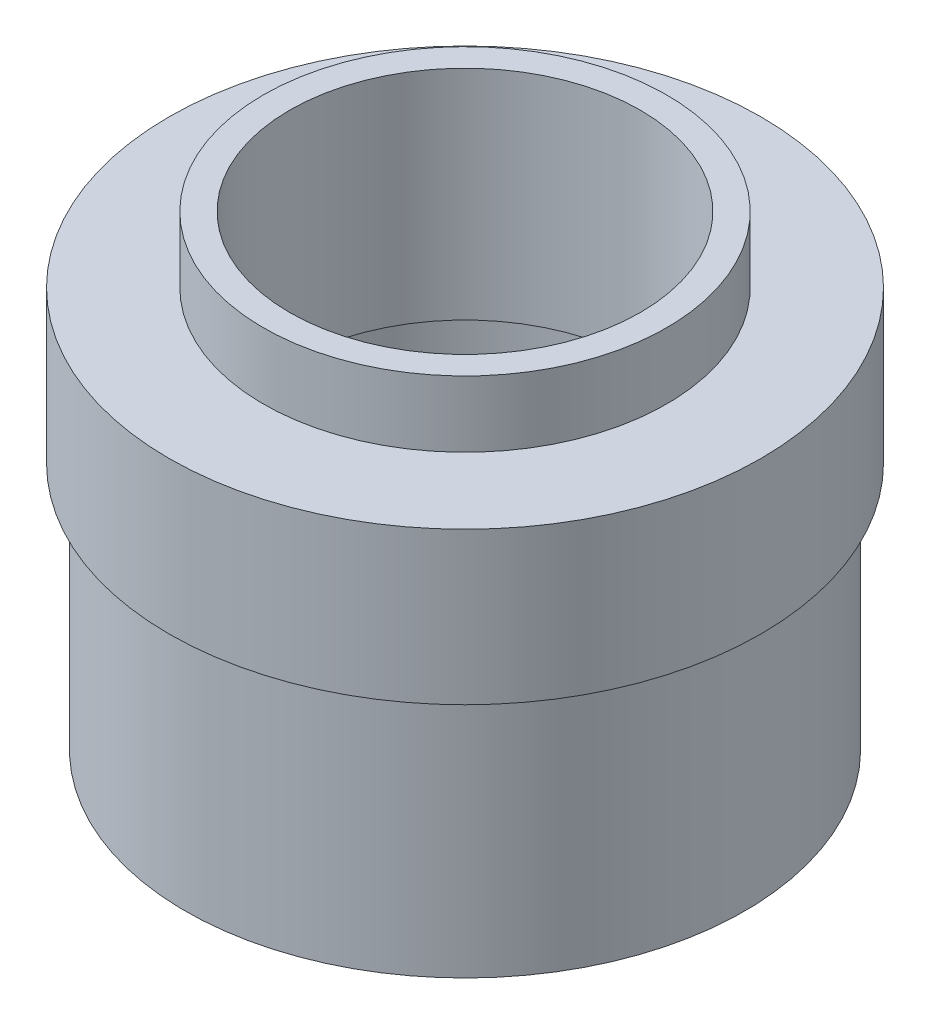
from build123d import *

# Parameters (mm, degrees)
SKETCH2_R          = 12.319
CUT_EXTRUDE2_DEPTH = 15.5448
SKETCH3_R          = 10.9855
CUT_EXTRUDE3_DEPTH = 40.253479183


with BuildPart() as part:
    # Sketch1 → Revolve2 (revolve)
    with BuildSketch(Plane.XY):
        Polygon((-18.542, 15.5448), (-17.526, 15.5448), (-17.526, 0), (0, 0), (0, 29.21), (-12.6365, 29.21), (-12.6365, 25.0698), (-18.542, 25.0698), align=None)
    revolve(axis=Axis((0, 29.21, 0), (0, -1, 0)))

    # Sketch2 → Cut-Extrude2 (cut)
    with BuildSketch(Plane.XZ):
        with Locations(Location((0, 0, 0), (0, 0, 270))):
            Circle(SKETCH2_R)
    extrude(amount=-CUT_EXTRUDE2_DEPTH, mode=Mode.SUBTRACT)

    # Sketch3 → Cut-Extrude3 (cut, through all)
    with BuildSketch(Plane(origin=(0, 29.21, 0), x_dir=(1, 0, 0), z_dir=(0, 1, 0))):
        with Locations(Location((0, 0, 0), (0, 0, 270))):
            Circle(SKETCH3_R)
    extrude(amount=-CUT_EXTRUDE3_DEPTH, mode=Mode.SUBTRACT)


solid = part.part
